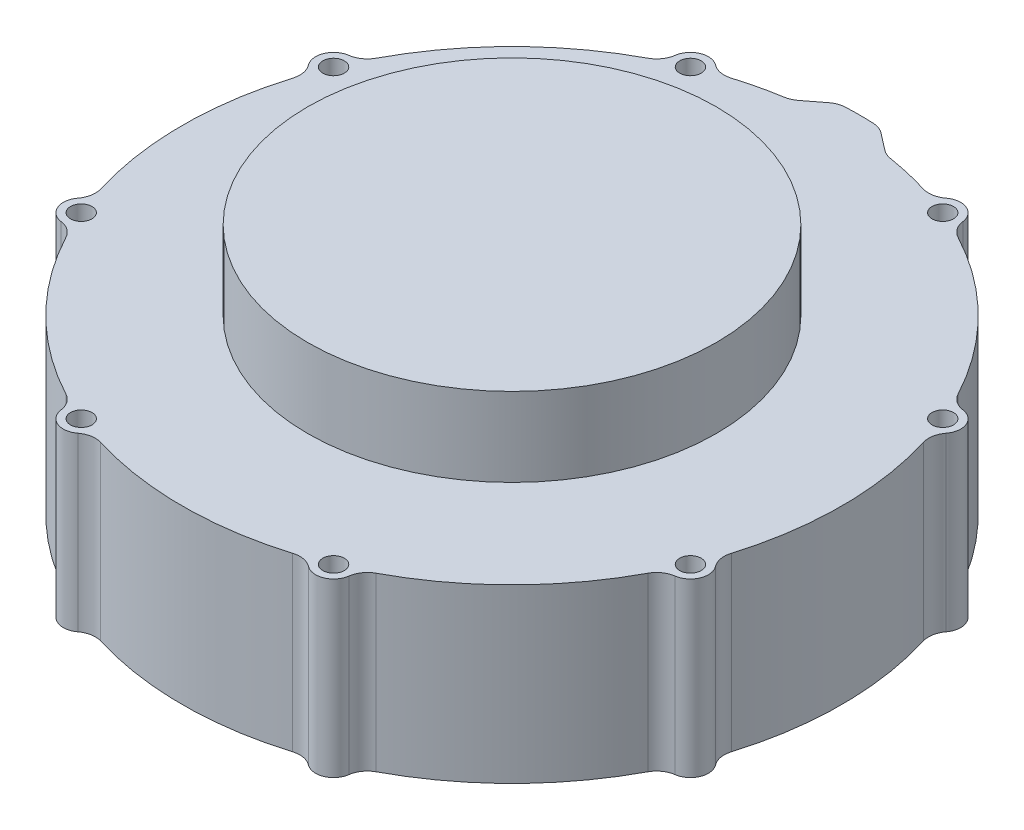
from build123d import *

# Parameters (mm, degrees)
SKETCH_1_R          = 1.5
EXTRUDE_1_DEPTH     = 24
FILLET_2_R          = 3
SKETCH_2_R          = 28.5
EXTRUDE_2_DEPTH     = 11
SKETCH_3_R          = 25
EXTRUDE_3_DEPTH     = 4.8
SKETCH_4_R          = 17
CUT_EXTRUDE_1_DEPTH = 15


with BuildPart() as part:
    # Эскиз1 → Бобышка-Вытянуть1 (new body)
    with BuildSketch(Plane(origin=(0, 0, 0), x_dir=(1, 0, 0), z_dir=(0, 1, 0))):
        with BuildLine():
            Line((2.889618177, 48.413842099), (6.655413532, 45.515991374))
            ThreePointArc((6.655413532, 45.515991374), (11.013324346, 44.6621393), (15.268594465, 43.392050229))
            ThreePointArc((15.268594465, 43.392050229), (18.56014647, 44.808157327), (19.886286281, 41.479339652))
            ThreePointArc((19.886286281, 41.479339652), (32.526911935, 32.526911935), (41.479339652, 19.886286281))
            ThreePointArc((41.479339652, 19.886286281), (44.808157327, 18.56014647), (43.392050229, 15.268594465))
            ThreePointArc((43.392050229, 15.268594465), (46, 0), (43.392050229, -15.268594465))
            ThreePointArc((43.392050229, -15.268594465), (44.808157327, -18.56014647), (41.479339652, -19.886286281))
            ThreePointArc((41.479339652, -19.886286281), (32.526911935, -32.526911935), (19.886286281, -41.479339652))
            ThreePointArc((19.886286281, -41.479339652), (18.56014647, -44.808157327), (15.268594465, -43.392050229))
            ThreePointArc((15.268594465, -43.392050229), (0, -46), (-15.268594465, -43.392050229))
            ThreePointArc((-15.268594465, -43.392050229), (-18.56014647, -44.808157327), (-19.886286281, -41.479339652))
            ThreePointArc((-19.886286281, -41.479339652), (-32.526911935, -32.526911935), (-41.479339652, -19.886286281))
            ThreePointArc((-41.479339652, -19.886286281), (-44.808157327, -18.56014647), (-43.392050229, -15.268594465))
            ThreePointArc((-43.392050229, -15.268594465), (-46, 0), (-43.392050229, 15.268594465))
            ThreePointArc((-43.392050229, 15.268594465), (-44.808157327, 18.56014647), (-41.479339652, 19.886286281))
            ThreePointArc((-41.479339652, 19.886286281), (-32.526911935, 32.526911935), (-19.886286281, 41.479339652))
            ThreePointArc((-19.886286281, 41.479339652), (-18.56014647, 44.808157327), (-15.268594465, 43.392050229))
            ThreePointArc((-15.268594465, 43.392050229), (-11.013324346, 44.6621393), (-6.655413532, 45.515991374))
            Line((-6.655413532, 45.515991374), (-2.889618177, 48.413842099))
            ThreePointArc((-2.889618177, 48.413842099), (0, 48.5), (2.889618177, 48.413842099))
        make_face()
        with Locations(Location((17.603437889, 42.498458496, 0), (0, 0, 270))):
            Circle(SKETCH_1_R, mode=Mode.SUBTRACT)
        with Locations(Location((42.498458496, 17.603437889, 0), (0, 0, 270))):
            Circle(SKETCH_1_R, mode=Mode.SUBTRACT)
        with Locations(Location((42.498458496, -17.603437889, 0), (0, 0, 270))):
            Circle(SKETCH_1_R, mode=Mode.SUBTRACT)
        with Locations(Location((17.603437889, -42.498458496, 0), (0, 0, 270))):
            Circle(SKETCH_1_R, mode=Mode.SUBTRACT)
        with Locations(Location((-17.603437889, -42.498458496, 0), (0, 0, 270))):
            Circle(SKETCH_1_R, mode=Mode.SUBTRACT)
        with Locations(Location((-42.498458496, -17.603437889, 0), (0, 0, 270))):
            Circle(SKETCH_1_R, mode=Mode.SUBTRACT)
        with Locations(Location((-42.498458496, 17.603437889, 0), (0, 0, 270))):
            Circle(SKETCH_1_R, mode=Mode.SUBTRACT)
        with Locations(Location((-17.603437889, 42.498458496, 0), (0, 0, 270))):
            Circle(SKETCH_1_R, mode=Mode.SUBTRACT)
    extrude(amount=EXTRUDE_1_DEPTH)

    # Скругление2
    fillet_2_edges = [part.edges().sort_by_distance(p)[0] for p in [
        (-43.392050229, 12, -15.268594465),
        (-41.479339652, 12, -19.886286281),
        (-19.886286281, 12, -41.479339652),
        (-15.268594465, 12, -43.392050229),
        (-6.655413532, 12, -45.515991374),
        (-2.889618177, 12, -48.413842099),
        (2.889618177, 12, -48.413842099),
        (6.655413532, 12, -45.515991374),
        (15.268594465, 12, -43.392050229),
        (19.886286281, 12, -41.479339652),
        (41.479339652, 12, -19.886286281),
        (43.392050229, 12, -15.268594465),
        (43.392050229, 12, 15.268594465),
        (41.479339652, 12, 19.886286281),
        (19.886286281, 12, 41.479339652),
        (15.268594465, 12, 43.392050229),
        (-15.268594465, 12, 43.392050229),
        (-19.886286281, 12, 41.479339652),
        (-41.479339652, 12, 19.886286281),
        (-43.392050229, 12, 15.268594465),
    ]]
    fillet(fillet_2_edges, radius=FILLET_2_R)

    # Эскиз2 → Бобышка-Вытянуть2 (add)
    with BuildSketch(Plane(origin=(0, 24, 0), x_dir=(1, 0, 0), z_dir=(0, 1, 0))):
        with Locations(Location((0, 0, 0), (0, 0, 270))):
            Circle(SKETCH_2_R)
    extrude(amount=EXTRUDE_2_DEPTH)

    # Эскиз3 → Бобышка-Вытянуть3 (add)
    with BuildSketch(Plane.XZ):
        with Locations(Location((0, 0, 0), (0, 0, 90))):
            Circle(SKETCH_3_R)
    extrude(amount=EXTRUDE_3_DEPTH)

    # Эскиз4 → Вырез-Вытянуть1 (cut)
    with BuildSketch(Plane.XZ.offset(4.8)):
        with Locations(Location((0, 0, 0), (0, 0, 270))):
            Circle(SKETCH_4_R)
    extrude(amount=-CUT_EXTRUDE_1_DEPTH, mode=Mode.SUBTRACT)


solid = part.part
